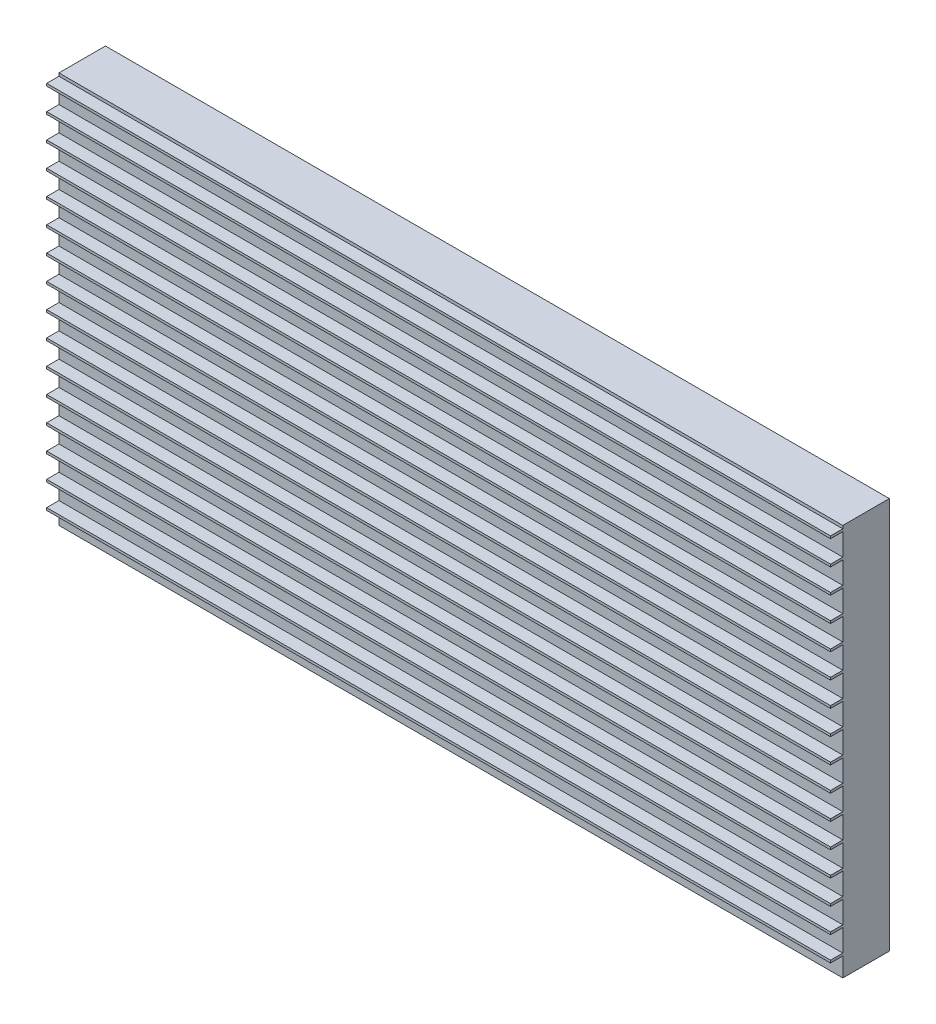
from build123d import *

# Parameters (mm, degrees)
SKETCH1_W           = 320
SKETCH1_H           = 160
BOSS_EXTRUDE1_DEPTH = 19
SKETCH4_W           = 320
SKETCH4_H           = 1
BOSS_EXTRUDE4_DEPTH = 5
LPATTERN2_COUNT     = 16
LPATTERN2_PITCH     = 10
SKETCH5_W           = 135
SKETCH5_H           = 120
CUT_EXTRUDE1_DEPTH  = 12
SKETCH6_R           = 2
CUT_EXTRUDE2_DEPTH  = 12
SKETCH7_R           = 1.5
BOSS_EXTRUDE5_DEPTH = 4
FILLET2_R           = 1.5


with BuildPart() as part:
    # Sketch1 → Boss-Extrude1 (new body)
    with BuildSketch(Plane.XY):
        Rectangle(SKETCH1_W, SKETCH1_H)
    extrude(amount=BOSS_EXTRUDE1_DEPTH)

    # Sketch4 → Boss-Extrude4 (add)
    with BuildSketch(Plane.XY.offset(19)):
        with Locations((0, 78.3)):
            Rectangle(SKETCH4_W, SKETCH4_H)
    boss_extrude4 = extrude(amount=BOSS_EXTRUDE4_DEPTH)

    # LPattern2: Boss-Extrude4 ×16
    with Locations(*[(0, -i * LPATTERN2_PITCH, 0) for i in range(1, LPATTERN2_COUNT)]):
        add(boss_extrude4)

    # Sketch5 → Cut-Extrude1 (cut)
    with BuildSketch(Plane(origin=(0, 0, 0), x_dir=(-1, 0, 0), z_dir=(0, 0, -1))):
        with Locations((-72.5, 0)):
            Rectangle(SKETCH5_W, SKETCH5_H)
        with Locations((72.5, 0)):
            Rectangle(SKETCH5_W, SKETCH5_H)
    extrude(amount=-CUT_EXTRUDE1_DEPTH, mode=Mode.SUBTRACT)

    # Sketch6 → Cut-Extrude2 (cut)
    with BuildSketch(Plane(origin=(0, 0, 0), x_dir=(-1, 0, 0), z_dir=(0, 0, -1))):
        with Locations((-143.75, 50)):
            Circle(SKETCH6_R)
        with Locations((-143.75, -50)):
            Circle(SKETCH6_R)
        with Locations((0, 66.25)):
            Circle(SKETCH6_R)
        with Locations((143.75, 50)):
            Circle(SKETCH6_R)
        with Locations((143.75, -50)):
            Circle(SKETCH6_R)
        with Locations((0, -66.25)):
            Circle(SKETCH6_R)
    extrude(amount=-CUT_EXTRUDE2_DEPTH, mode=Mode.SUBTRACT)

    # Sketch7 → Boss-Extrude5 (add)
    with BuildSketch(Plane(origin=(0, 0, 0), x_dir=(-1, 0, 0), z_dir=(0, 0, -1))):
        with Locations(Location((-120, 66, 0), (0, 0, 180))):
            Circle(SKETCH7_R)
        with Locations(Location((120, 66, 0), (0, 0, 180))):
            Circle(SKETCH7_R)
        with Locations(Location((120, -66, 0), (0, 0, 180))):
            Circle(SKETCH7_R)
        with Locations(Location((-120, -66, 0), (0, 0, 180))):
            Circle(SKETCH7_R)
    extrude(amount=BOSS_EXTRUDE5_DEPTH)

    # Fillet2
    fillet2_edges = [part.edges().sort_by_distance(p)[0] for p in [
        (118.5, 66, -4),
        (-121.5, 66, -4),
        (-121.5, -66, -4),
        (118.5, -66, -4),
    ]]
    fillet(fillet2_edges, radius=FILLET2_R)


solid = part.part
